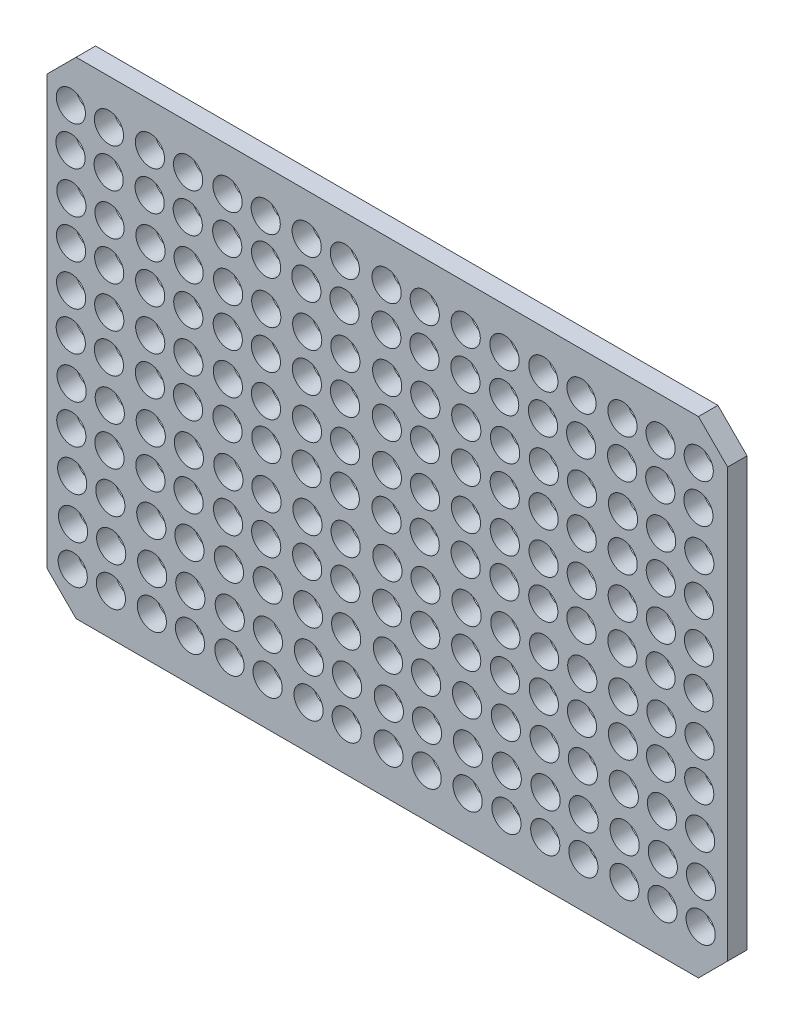
from build123d import *

# Parameters (mm, degrees)
SKETCH_1_W          = 70
SKETCH_1_H          = 50
EXTRUDE_1_DEPTH     = 2
SKETCH_2_R          = 1.5
CUT_EXTRUDE_1_DEPTH = 44.058100283
CHAMFER_1_SIZE      = 3


with BuildPart() as part:
    # 草图1 → 凸台-拉伸1 (new body)
    with BuildSketch(Plane.XY):
        Rectangle(SKETCH_1_W, SKETCH_1_H)
    extrude(amount=EXTRUDE_1_DEPTH)

    # 草图2 → 切除-拉伸1 (cut, through all)
    with BuildSketch(Plane.XY.offset(2)):
        with Locations((-32.541141755, 20.447168312)):
            Circle(SKETCH_2_R)
        with Locations((-28.61877199, 20.447168312)):
            Circle(SKETCH_2_R)
        with Locations((-24.405856316, 20.519804789)):
            Circle(SKETCH_2_R)
        with Locations((-20.483486551, 20.519804789)):
            Circle(SKETCH_2_R)
        with Locations((-16.423876104, 20.614779229)):
            Circle(SKETCH_2_R)
        with Locations((-12.501506339, 20.614779229)):
            Circle(SKETCH_2_R)
        with Locations((-8.288590665, 20.687415706)):
            Circle(SKETCH_2_R)
        with Locations((-4.3662209, 20.687415706)):
            Circle(SKETCH_2_R)
        with Locations((-0.068620341, 20.690227001)):
            Circle(SKETCH_2_R)
        with Locations((3.853749424, 20.690227001)):
            Circle(SKETCH_2_R)
        with Locations((8.066665098, 20.762863478)):
            Circle(SKETCH_2_R)
        with Locations((12.057655204, 20.762863478)):
            Circle(SKETCH_2_R)
        with Locations((16.04864531, 20.857837918)):
            Circle(SKETCH_2_R)
        with Locations((19.971015075, 20.857837918)):
            Circle(SKETCH_2_R)
        with Locations((24.183930749, 20.930474395)):
            Circle(SKETCH_2_R)
        with Locations((28.106300514, 20.930474395)):
            Circle(SKETCH_2_R)
        with Locations((32.028670279, 20.882987175)):
            Circle(SKETCH_2_R)
        with Locations((-32.575451925, 16.42841846)):
            Circle(SKETCH_2_R)
        with Locations((-28.65308216, 16.42841846)):
            Circle(SKETCH_2_R)
        with Locations((-24.440166487, 16.501054937)):
            Circle(SKETCH_2_R)
        with Locations((-20.517796721, 16.501054937)):
            Circle(SKETCH_2_R)
        with Locations((-16.458186274, 16.596029377)):
            Circle(SKETCH_2_R)
        with Locations((-12.463180032, 16.741302331)):
            Circle(SKETCH_2_R)
        with Locations((-8.322900835, 16.668665854)):
            Circle(SKETCH_2_R)
        with Locations((-4.40053107, 16.668665854)):
            Circle(SKETCH_2_R)
        with Locations((-0.102930512, 16.671477149)):
            Circle(SKETCH_2_R)
        with Locations((3.819439253, 16.671477149)):
            Circle(SKETCH_2_R)
        with Locations((8.032354927, 16.744113626)):
            Circle(SKETCH_2_R)
        with Locations((12.023345033, 16.744113626)):
            Circle(SKETCH_2_R)
        with Locations((16.014335139, 16.839088066)):
            Circle(SKETCH_2_R)
        with Locations((19.936704904, 16.839088066)):
            Circle(SKETCH_2_R)
        with Locations((24.149620578, 16.911724543)):
            Circle(SKETCH_2_R)
        with Locations((28.071990343, 16.911724543)):
            Circle(SKETCH_2_R)
        with Locations((31.994360108, 16.864237323)):
            Circle(SKETCH_2_R)
        with Locations((-32.485660363, 12.191056353)):
            Circle(SKETCH_2_R)
        with Locations((-28.563290598, 12.191056353)):
            Circle(SKETCH_2_R)
        with Locations((-24.350374924, 12.26369283)):
            Circle(SKETCH_2_R)
        with Locations((-20.428005159, 12.26369283)):
            Circle(SKETCH_2_R)
        with Locations((-16.368394712, 12.35866727)):
            Circle(SKETCH_2_R)
        with Locations((-12.446024947, 12.35866727)):
            Circle(SKETCH_2_R)
        with Locations((-8.233109273, 12.431303747)):
            Circle(SKETCH_2_R)
        with Locations((-4.310739508, 12.431303747)):
            Circle(SKETCH_2_R)
        with Locations((-0.013138949, 12.434115042)):
            Circle(SKETCH_2_R)
        with Locations((3.909230816, 12.434115042)):
            Circle(SKETCH_2_R)
        with Locations((8.122146489, 12.506751519)):
            Circle(SKETCH_2_R)
        with Locations((12.113136596, 12.506751519)):
            Circle(SKETCH_2_R)
        with Locations((16.104126702, 12.601725958)):
            Circle(SKETCH_2_R)
        with Locations((20.026496467, 12.601725958)):
            Circle(SKETCH_2_R)
        with Locations((24.23941214, 12.674362436)):
            Circle(SKETCH_2_R)
        with Locations((28.161781905, 12.674362436)):
            Circle(SKETCH_2_R)
        with Locations((32.084151671, 12.626875216)):
            Circle(SKETCH_2_R)
        with Locations((-32.519970533, 8.172306501)):
            Circle(SKETCH_2_R)
        with Locations((-28.597600768, 8.172306501)):
            Circle(SKETCH_2_R)
        with Locations((-24.384685095, 8.244942978)):
            Circle(SKETCH_2_R)
        with Locations((-20.46231533, 8.244942978)):
            Circle(SKETCH_2_R)
        with Locations((-16.402704882, 8.339917418)):
            Circle(SKETCH_2_R)
        with Locations((-12.480335117, 8.339917418)):
            Circle(SKETCH_2_R)
        with Locations((-8.267419444, 8.412553895)):
            Circle(SKETCH_2_R)
        with Locations((-4.345049679, 8.412553895)):
            Circle(SKETCH_2_R)
        with Locations((-0.04744912, 8.41536519)):
            Circle(SKETCH_2_R)
        with Locations((3.874920645, 8.41536519)):
            Circle(SKETCH_2_R)
        with Locations((8.087836319, 8.488001667)):
            Circle(SKETCH_2_R)
        with Locations((12.078826425, 8.488001667)):
            Circle(SKETCH_2_R)
        with Locations((16.069816531, 8.582976106)):
            Circle(SKETCH_2_R)
        with Locations((19.992186296, 8.582976106)):
            Circle(SKETCH_2_R)
        with Locations((24.20510197, 8.655612583)):
            Circle(SKETCH_2_R)
        with Locations((28.127471735, 8.655612583)):
            Circle(SKETCH_2_R)
        with Locations((32.0498415, 8.608125364)):
            Circle(SKETCH_2_R)
        with Locations((-32.513401059, 3.97091122)):
            Circle(SKETCH_2_R)
        with Locations((-28.591031294, 3.97091122)):
            Circle(SKETCH_2_R)
        with Locations((-24.37811562, 4.043547698)):
            Circle(SKETCH_2_R)
        with Locations((-20.455745855, 4.043547698)):
            Circle(SKETCH_2_R)
        with Locations((-16.396135408, 4.138522137)):
            Circle(SKETCH_2_R)
        with Locations((-12.473765643, 4.138522137)):
            Circle(SKETCH_2_R)
        with Locations((-8.260849969, 4.211158614)):
            Circle(SKETCH_2_R)
        with Locations((-4.338480204, 4.211158614)):
            Circle(SKETCH_2_R)
        with Locations((-0.040879645, 4.213969909)):
            Circle(SKETCH_2_R)
        with Locations((3.88149012, 4.213969909)):
            Circle(SKETCH_2_R)
        with Locations((8.094405793, 4.286606386)):
            Circle(SKETCH_2_R)
        with Locations((12.0853959, 4.286606386)):
            Circle(SKETCH_2_R)
        with Locations((16.076386006, 4.381580826)):
            Circle(SKETCH_2_R)
        with Locations((19.998755771, 4.381580826)):
            Circle(SKETCH_2_R)
        with Locations((24.211671445, 4.454217303)):
            Circle(SKETCH_2_R)
        with Locations((28.13404121, 4.454217303)):
            Circle(SKETCH_2_R)
        with Locations((32.056410975, 4.406730083)):
            Circle(SKETCH_2_R)
        with Locations((-32.547711229, -0.047838632)):
            Circle(SKETCH_2_R)
        with Locations((-28.625341464, -0.047838632)):
            Circle(SKETCH_2_R)
        with Locations((-24.412425791, 0.024797846)):
            Circle(SKETCH_2_R)
        with Locations((-20.490056026, 0.024797846)):
            Circle(SKETCH_2_R)
        with Locations((-16.430445578, 0.119772285)):
            Circle(SKETCH_2_R)
        with Locations((-12.435439336, 0.265045239)):
            Circle(SKETCH_2_R)
        with Locations((-8.29516014, 0.192408762)):
            Circle(SKETCH_2_R)
        with Locations((-4.372790374, 0.192408762)):
            Circle(SKETCH_2_R)
        with Locations((-0.075189816, 0.195220057)):
            Circle(SKETCH_2_R)
        with Locations((3.847179949, 0.195220057)):
            Circle(SKETCH_2_R)
        with Locations((8.060095623, 0.267856534)):
            Circle(SKETCH_2_R)
        with Locations((12.051085729, 0.267856534)):
            Circle(SKETCH_2_R)
        with Locations((16.042075835, 0.362830974)):
            Circle(SKETCH_2_R)
        with Locations((19.9644456, 0.362830974)):
            Circle(SKETCH_2_R)
        with Locations((24.177361274, 0.435467451)):
            Circle(SKETCH_2_R)
        with Locations((28.099731039, 0.435467451)):
            Circle(SKETCH_2_R)
        with Locations((32.022100804, 0.387980231)):
            Circle(SKETCH_2_R)
        with Locations((-32.457919667, -4.285200739)):
            Circle(SKETCH_2_R)
        with Locations((-28.535549902, -4.285200739)):
            Circle(SKETCH_2_R)
        with Locations((-24.322634228, -4.212564262)):
            Circle(SKETCH_2_R)
        with Locations((-20.400264463, -4.212564262)):
            Circle(SKETCH_2_R)
        with Locations((-16.340654016, -4.117589822)):
            Circle(SKETCH_2_R)
        with Locations((-12.418284251, -4.117589822)):
            Circle(SKETCH_2_R)
        with Locations((-8.205368577, -4.044953345)):
            Circle(SKETCH_2_R)
        with Locations((-4.282998812, -4.044953345)):
            Circle(SKETCH_2_R)
        with Locations((0.014601747, -4.04214205)):
            Circle(SKETCH_2_R)
        with Locations((3.936971512, -4.04214205)):
            Circle(SKETCH_2_R)
        with Locations((8.149887185, -3.969505573)):
            Circle(SKETCH_2_R)
        with Locations((12.140877291, -3.969505573)):
            Circle(SKETCH_2_R)
        with Locations((16.131867398, -3.874531133)):
            Circle(SKETCH_2_R)
        with Locations((20.054237163, -3.874531133)):
            Circle(SKETCH_2_R)
        with Locations((24.267152836, -3.801894656)):
            Circle(SKETCH_2_R)
        with Locations((28.189522601, -3.801894656)):
            Circle(SKETCH_2_R)
        with Locations((32.111892366, -3.849381876)):
            Circle(SKETCH_2_R)
        with Locations((-32.492229837, -8.303950591)):
            Circle(SKETCH_2_R)
        with Locations((-28.569860072, -8.303950591)):
            Circle(SKETCH_2_R)
        with Locations((-24.356944399, -8.231314114)):
            Circle(SKETCH_2_R)
        with Locations((-20.434574634, -8.231314114)):
            Circle(SKETCH_2_R)
        with Locations((-16.374964186, -8.136339674)):
            Circle(SKETCH_2_R)
        with Locations((-12.452594421, -8.136339674)):
            Circle(SKETCH_2_R)
        with Locations((-8.239678748, -8.063703197)):
            Circle(SKETCH_2_R)
        with Locations((-4.317308983, -8.063703197)):
            Circle(SKETCH_2_R)
        with Locations((-0.019708424, -8.060891902)):
            Circle(SKETCH_2_R)
        with Locations((3.902661341, -8.060891902)):
            Circle(SKETCH_2_R)
        with Locations((8.115577015, -7.988255425)):
            Circle(SKETCH_2_R)
        with Locations((12.106567121, -7.988255425)):
            Circle(SKETCH_2_R)
        with Locations((16.097557227, -7.893280986)):
            Circle(SKETCH_2_R)
        with Locations((20.019926992, -7.893280986)):
            Circle(SKETCH_2_R)
        with Locations((24.232842666, -7.820644508)):
            Circle(SKETCH_2_R)
        with Locations((28.155212431, -7.820644508)):
            Circle(SKETCH_2_R)
        with Locations((32.077582196, -7.868131728)):
            Circle(SKETCH_2_R)
        with Locations((-32.402438275, -12.493122655)):
            Circle(SKETCH_2_R)
        with Locations((-28.48006851, -12.493122655)):
            Circle(SKETCH_2_R)
        with Locations((-24.267152836, -12.420486177)):
            Circle(SKETCH_2_R)
        with Locations((-20.344783071, -12.420486177)):
            Circle(SKETCH_2_R)
        with Locations((-16.285172624, -12.325511738)):
            Circle(SKETCH_2_R)
        with Locations((-12.290166382, -12.180238784)):
            Circle(SKETCH_2_R)
        with Locations((-8.149887185, -12.252875261)):
            Circle(SKETCH_2_R)
        with Locations((-4.22751742, -12.252875261)):
            Circle(SKETCH_2_R)
        with Locations((0.070083138, -12.250063966)):
            Circle(SKETCH_2_R)
        with Locations((3.992452904, -12.250063966)):
            Circle(SKETCH_2_R)
        with Locations((8.205368577, -12.177427489)):
            Circle(SKETCH_2_R)
        with Locations((12.196358683, -12.177427489)):
            Circle(SKETCH_2_R)
        with Locations((16.18734879, -12.082453049)):
            Circle(SKETCH_2_R)
        with Locations((20.109718555, -12.082453049)):
            Circle(SKETCH_2_R)
        with Locations((24.322634228, -12.009816572)):
            Circle(SKETCH_2_R)
        with Locations((28.245003993, -12.009816572)):
            Circle(SKETCH_2_R)
        with Locations((32.167373758, -12.057303792)):
            Circle(SKETCH_2_R)
        with Locations((-32.312646713, -16.730484762)):
            Circle(SKETCH_2_R)
        with Locations((-28.390276948, -16.730484762)):
            Circle(SKETCH_2_R)
        with Locations((-24.177361274, -16.657848285)):
            Circle(SKETCH_2_R)
        with Locations((-20.254991509, -16.657848285)):
            Circle(SKETCH_2_R)
        with Locations((-16.195381062, -16.562873845)):
            Circle(SKETCH_2_R)
        with Locations((-12.273011296, -16.562873845)):
            Circle(SKETCH_2_R)
        with Locations((-8.060095623, -16.490237368)):
            Circle(SKETCH_2_R)
        with Locations((-4.137725858, -16.490237368)):
            Circle(SKETCH_2_R)
        with Locations((0.159874701, -16.487426073)):
            Circle(SKETCH_2_R)
        with Locations((4.082244466, -16.487426073)):
            Circle(SKETCH_2_R)
        with Locations((8.29516014, -16.414789596)):
            Circle(SKETCH_2_R)
        with Locations((12.286150246, -16.414789596)):
            Circle(SKETCH_2_R)
        with Locations((16.277140352, -16.319815156)):
            Circle(SKETCH_2_R)
        with Locations((20.199510117, -16.319815156)):
            Circle(SKETCH_2_R)
        with Locations((24.412425791, -16.247178679)):
            Circle(SKETCH_2_R)
        with Locations((28.334795556, -16.247178679)):
            Circle(SKETCH_2_R)
        with Locations((32.257165321, -16.294665899)):
            Circle(SKETCH_2_R)
        with Locations((-32.346956883, -20.749234614)):
            Circle(SKETCH_2_R)
        with Locations((-28.424587118, -20.749234614)):
            Circle(SKETCH_2_R)
        with Locations((-24.211671445, -20.676598137)):
            Circle(SKETCH_2_R)
        with Locations((-20.289301679, -20.676598137)):
            Circle(SKETCH_2_R)
        with Locations((-16.229691232, -20.581623697)):
            Circle(SKETCH_2_R)
        with Locations((-12.307321467, -20.581623697)):
            Circle(SKETCH_2_R)
        with Locations((-8.094405793, -20.50898722)):
            Circle(SKETCH_2_R)
        with Locations((-4.172036028, -20.50898722)):
            Circle(SKETCH_2_R)
        with Locations((0.12556453, -20.506175925)):
            Circle(SKETCH_2_R)
        with Locations((4.047934295, -20.506175925)):
            Circle(SKETCH_2_R)
        with Locations((8.260849969, -20.433539448)):
            Circle(SKETCH_2_R)
        with Locations((12.251840075, -20.433539448)):
            Circle(SKETCH_2_R)
        with Locations((16.242830181, -20.338565009)):
            Circle(SKETCH_2_R)
        with Locations((20.165199946, -20.338565009)):
            Circle(SKETCH_2_R)
        with Locations((24.37811562, -20.265928531)):
            Circle(SKETCH_2_R)
        with Locations((28.300485385, -20.265928531)):
            Circle(SKETCH_2_R)
        with Locations((32.22285515, -20.313415751)):
            Circle(SKETCH_2_R)
    extrude(amount=-CUT_EXTRUDE_1_DEPTH, mode=Mode.SUBTRACT)

    # 倒角1
    chamfer_1_edges = [part.edges().sort_by_distance(p)[0] for p in [
        (35, -25, 1),
        (-35, -25, 1),
        (-35, 25, 1),
        (35, 25, 1),
    ]]
    chamfer(chamfer_1_edges, length=CHAMFER_1_SIZE)


solid = part.part
